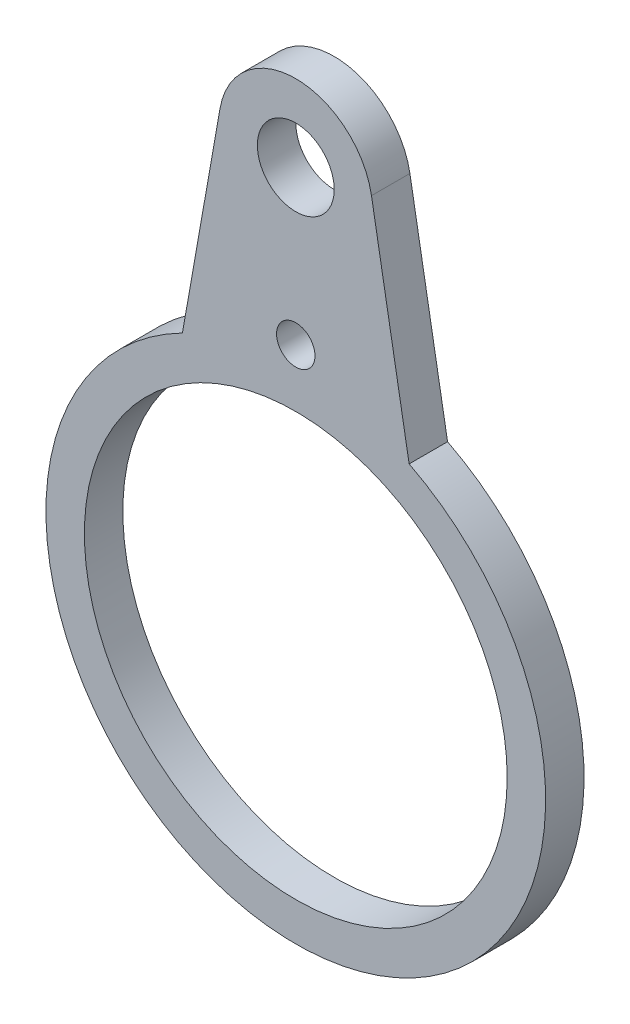
from build123d import *

# Parameters (mm, degrees)
SKETCH2_R           = 5
BOSS_EXTRUDE1_DEPTH = 10
SKETCH3_R           = 10
SKETCH3_R_2         = 5
BOSS_EXTRUDE2_DEPTH = 76.2
BOSS_EXTRUDE3_START = 86.2
SKETCH2_2_R         = 5
BOSS_EXTRUDE3_DEPTH = 10
SKETCH5_R           = 65
BOSS_EXTRUDE4_DEPTH = 10
SKETCH6_R           = 55
CUT_EXTRUDE1_DEPTH  = 10
SKETCH7_R           = 80
CUT_EXTRUDE2_DEPTH  = 135.370532484
SKETCH8_R           = 10
BOSS_EXTRUDE6_DEPTH = 10


with BuildPart() as part:
    # Sketch2 → Boss-Extrude1 (new body)
    with BuildSketch(Plane.XY):
        with BuildLine():
            Line((-19.794866372, 2.857142857), (-9.897433186, 71.428571429))
            ThreePointArc((-9.897433186, 71.428571429), (0, 80), (9.897433186, 71.428571429))
            Line((9.897433186, 71.428571429), (19.794866372, 2.857142857))
            ThreePointArc((19.794866372, 2.857142857), (0, -20), (-19.794866372, 2.857142857))
        make_face()
        with Locations((0, 70)):
            Circle(SKETCH2_R, mode=Mode.SUBTRACT)
        with BuildLine():
            Line((-2.5, 9.682458366), (-2.5, 12))
            Line((-2.5, 12), (2.5, 12))
            Line((2.5, 12), (2.5, 9.682458366))
            ThreePointArc((2.5, 9.682458366), (0, -10), (-2.5, 9.682458366))
        make_face(mode=Mode.SUBTRACT)
    extrude(amount=BOSS_EXTRUDE1_DEPTH)

    # Sketch3 → Boss-Extrude2 (add)
    with BuildSketch(Plane.XY.offset(10)):
        with Locations(Location((0, 70, 0), (0, 0, 171.786789298))):
            Circle(SKETCH3_R)
        with Locations((0, 70)):
            Circle(SKETCH3_R_2, mode=Mode.SUBTRACT)
    extrude(amount=BOSS_EXTRUDE2_DEPTH)

    # Sketch2<2> → Boss-Extrude3 (add)
    with BuildSketch(Plane.XY.offset(BOSS_EXTRUDE3_START)):
        with BuildLine():
            Line((-19.794866372, 2.857142857), (-9.897433186, 71.428571429))
            ThreePointArc((-9.897433186, 71.428571429), (0, 80), (9.897433186, 71.428571429))
            Line((9.897433186, 71.428571429), (19.794866372, 2.857142857))
            ThreePointArc((19.794866372, 2.857142857), (0, -20), (-19.794866372, 2.857142857))
        make_face()
        with Locations((0, 70)):
            Circle(SKETCH2_2_R, mode=Mode.SUBTRACT)
        with BuildLine():
            Line((-2.5, 9.682458366), (-2.5, 12))
            Line((-2.5, 12), (2.5, 12))
            Line((2.5, 12), (2.5, 9.682458366))
            ThreePointArc((2.5, 9.682458366), (0, -10), (-2.5, 9.682458366))
        make_face(mode=Mode.SUBTRACT)
    extrude(amount=BOSS_EXTRUDE3_DEPTH)

    # Sketch5 → Boss-Extrude4 (add)
    with BuildSketch(Plane.XY.offset(96.2)):
        Circle(SKETCH5_R)
    extrude(amount=-BOSS_EXTRUDE4_DEPTH)

    # Sketch6 → Cut-Extrude1 (cut)
    with BuildSketch(Plane.XY.offset(96.2)):
        Circle(SKETCH6_R)
    extrude(amount=-CUT_EXTRUDE1_DEPTH, mode=Mode.SUBTRACT)

    # Sketch7 → Cut-Extrude2 (cut, through all)
    with BuildSketch(Plane(origin=(0, 0, 86.2), x_dir=(-1, 0, 0), z_dir=(0, 0, -1))):
        Circle(SKETCH7_R)
    extrude(amount=CUT_EXTRUDE2_DEPTH, mode=Mode.SUBTRACT)

    # Sketch8 → Boss-Extrude6 (add)
    with BuildSketch(Plane.XY.offset(96.2)):
        with BuildLine():
            Line((-19.69615506, 113.472963553), (-29.490777376, 57.924900084))
            ThreePointArc((-29.490777376, 57.924900084), (-20.457217444, 61.696857736), (-10.959640032, 64.06938653))
            Line((-10.959640032, 64.06938653), (-9.897433186, 71.428571429))
            ThreePointArc((-9.897433186, 71.428571429), (0, 80), (9.897433186, 71.428571429))
            Line((9.897433186, 71.428571429), (10.959640032, 64.06938653))
            ThreePointArc((10.959640032, 64.06938653), (20.457217444, 61.696857736), (29.490777376, 57.924900084))
            Line((29.490777376, 57.924900084), (19.69615506, 113.472963553))
            ThreePointArc((19.69615506, 113.472963553), (0, 130), (-19.69615506, 113.472963553))
        make_face()
        with Locations((0, 110)):
            Circle(SKETCH8_R, mode=Mode.SUBTRACT)
    extrude(amount=-BOSS_EXTRUDE6_DEPTH)


solid = part.part
